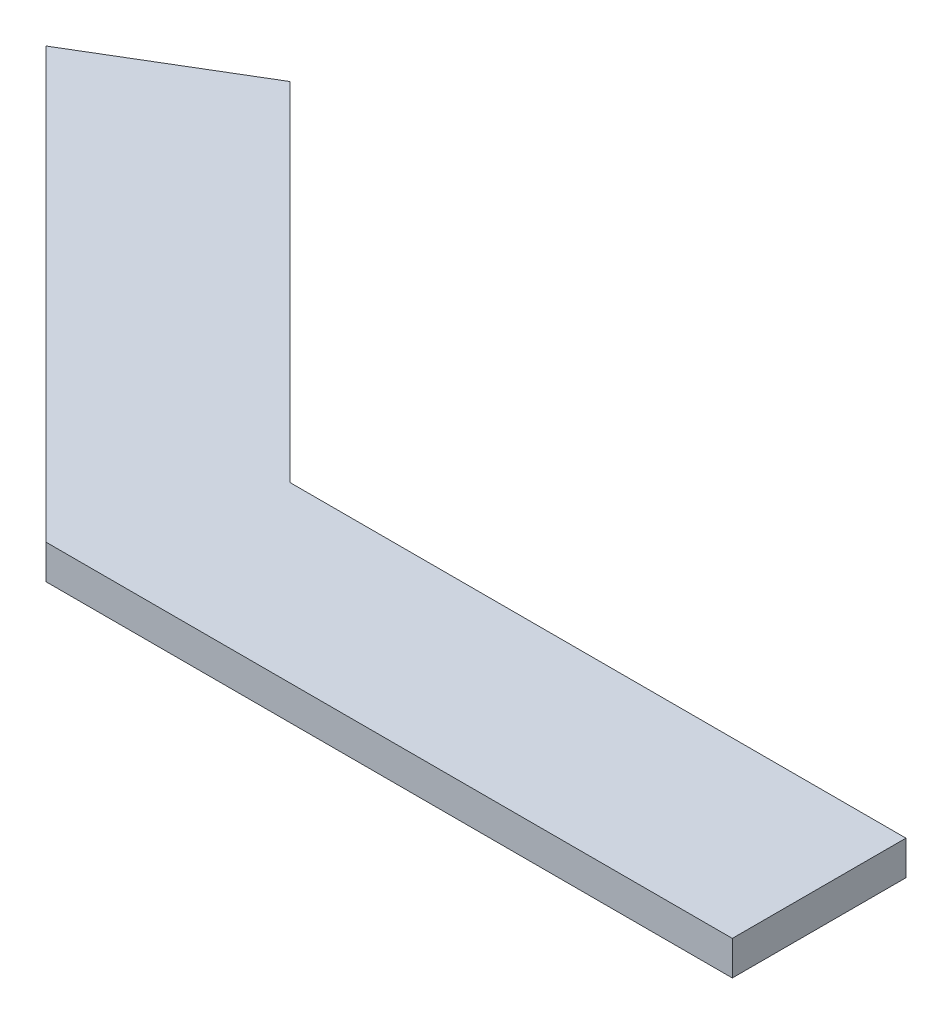
from build123d import *

# Parameters (mm, degrees)
BOSS_EXTRUDE4_DEPTH = 5


with BuildPart() as part:
    # Sketch5 → Boss-Extrude4 (new body)
    with BuildSketch(Plane.XZ.offset(20.3)):
        Polygon((0, 100), (-62.613989109, 37.386010891), (-40.345458425, 24.089756452), (10.264785123, 74.7), (100, 74.7), (100, 100), align=None)
    extrude(amount=BOSS_EXTRUDE4_DEPTH)


solid = part.part
